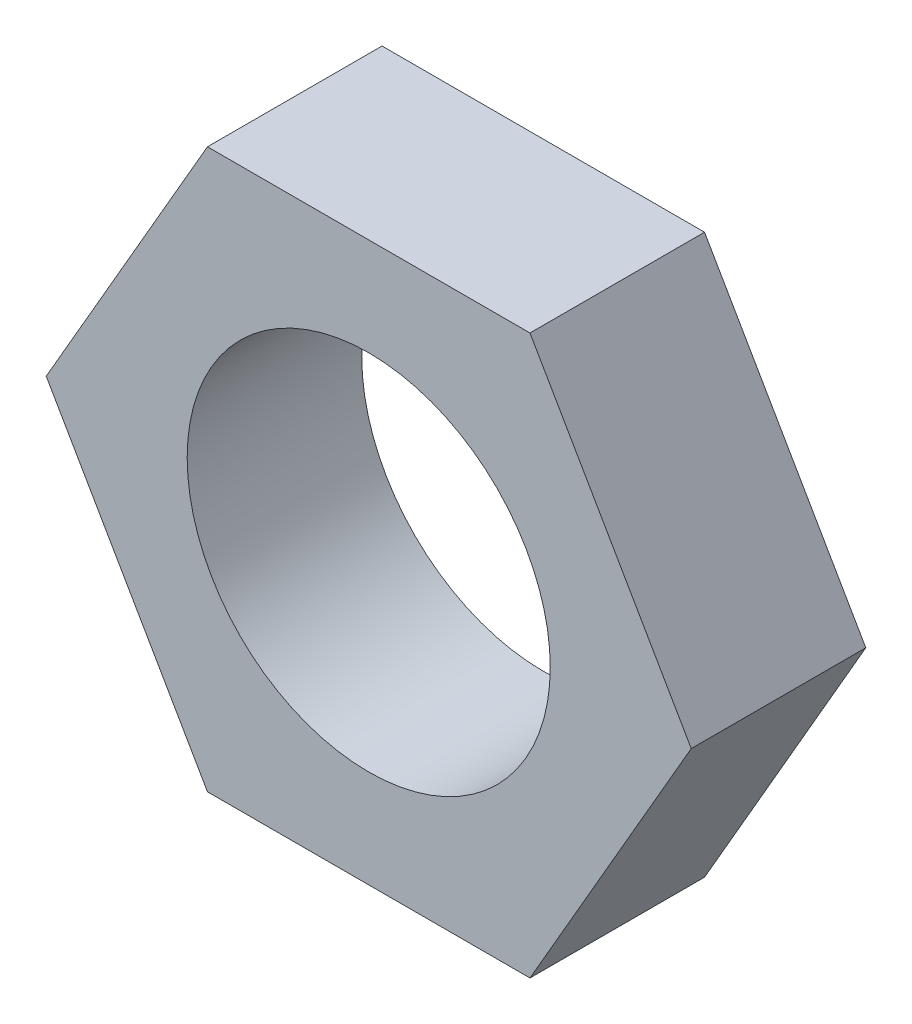
from build123d import *

# Parameters (mm, degrees)
SKETCH_1_R       = 2.6
EXTRUDE_M5_DEPTH = 2.5


with BuildPart() as part:
    # 草图1 → M5薄螺母外形占位 (new body)
    with BuildSketch(Plane.XY):
        Polygon((4.618802154, 0), (2.309401077, 4), (-2.309401077, 4), (-4.618802154, 0), (-2.309401077, -4), (2.309401077, -4), align=None)
        Circle(SKETCH_1_R, mode=Mode.SUBTRACT)
    extrude(amount=EXTRUDE_M5_DEPTH)


solid = part.part
